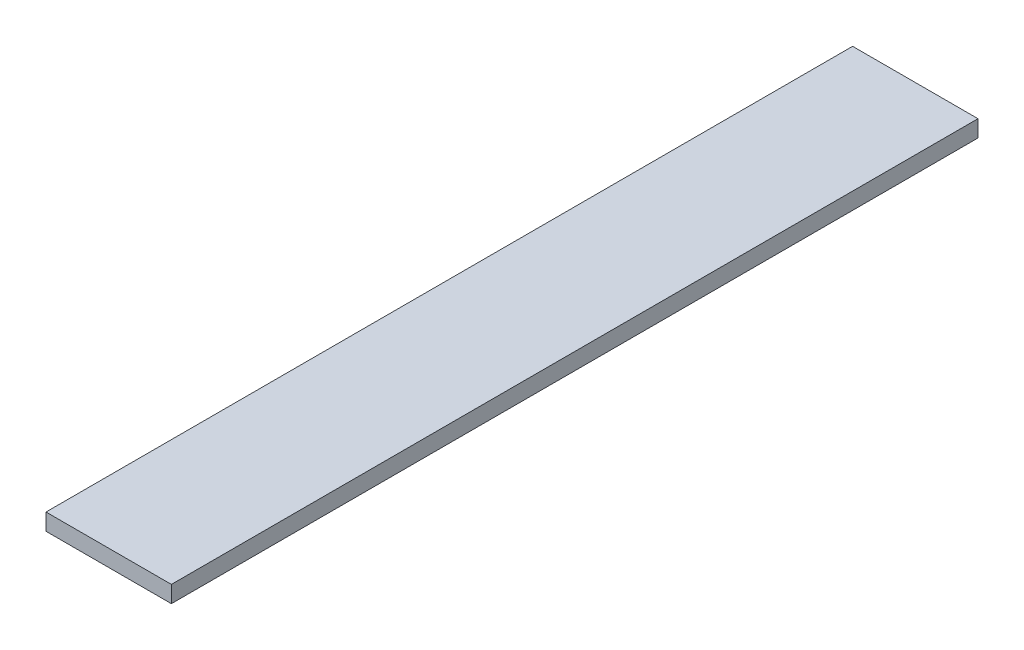
from build123d import *

# Parameters (mm, degrees)
CROQUIS1_W              = 300
CROQUIS1_H              = 40
SALIENTE_EXTRUIR1_DEPTH = 1930


with BuildPart() as part:
    # Croquis1 → Saliente-Extruir1 (new body)
    with BuildSketch(Plane.XY):
        with Locations((53.77403468, 20)):
            Rectangle(CROQUIS1_W, CROQUIS1_H)
    extrude(amount=SALIENTE_EXTRUIR1_DEPTH)


solid = part.part
